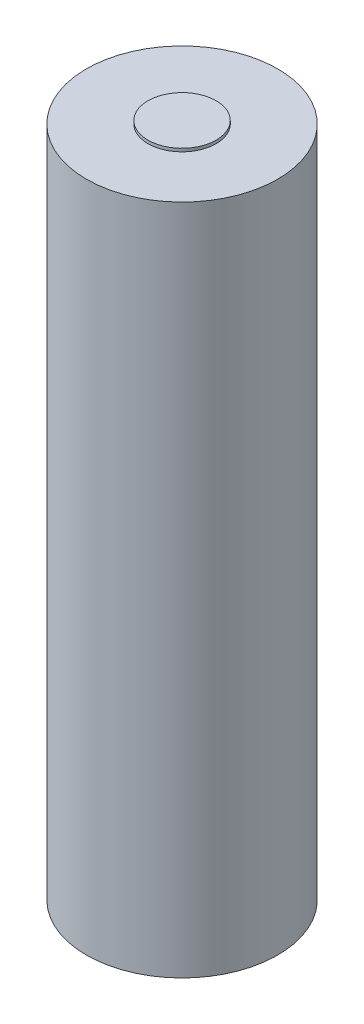
from build123d import *

# Parameters (mm, degrees)
SKETCH_1_R      = 9.25
EXTRUDE_1_DEPTH = 65
SKETCH_2_R      = 3.3
EXTRUDE_2_DEPTH = 0.3


with BuildPart() as part:
    # 스케치1 → 보스-돌출1 (new body)
    with BuildSketch(Plane(origin=(0, 0, 0), x_dir=(1, 0, 0), z_dir=(0, 1, 0))):
        with Locations(Location((0, 0, 0), (0, 0, 270))):
            Circle(SKETCH_1_R)
    extrude(amount=EXTRUDE_1_DEPTH)

    # 스케치2 → 보스-돌출2 (add)
    with BuildSketch(Plane(origin=(0, 65, 0), x_dir=(1, 0, 0), z_dir=(0, 1, 0))):
        with Locations(Location((0, 0, 0), (0, 0, 270))):
            Circle(SKETCH_2_R)
    extrude(amount=EXTRUDE_2_DEPTH)


solid = part.part
